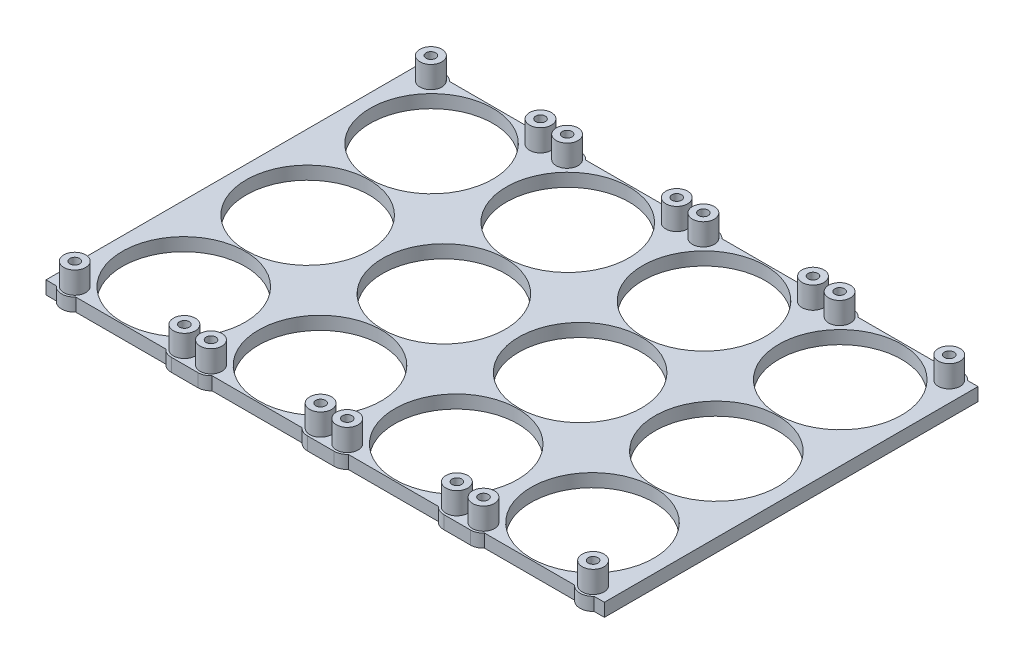
from build123d import *

# Parameters (mm, degrees)
SKETCH1_W           = 127.76
SKETCH1_H           = 85.48
SKETCH1_R           = 14.05
BOSS_EXTRUDE3_DEPTH = 3
BOSS_EXTRUDE4_DEPTH = 3
BOSS_EXTRUDE5_START = 3
SKETCH7_R           = 2.5
BOSS_EXTRUDE5_DEPTH = 5
CUT_EXTRUDE1_START  = 5
SKETCH4_R           = 1.1
CUT_EXTRUDE1_DEPTH  = 5


with BuildPart() as part:
    # Sketch1 → Boss-Extrude3 (new body)
    with BuildSketch(Plane(origin=(0, 0, 0), x_dir=(1, 0, 0), z_dir=(0, 1, 0))):
        with Locations((63.88, -42.74)):
            Rectangle(SKETCH1_W, SKETCH1_H)
        with Locations(Location((17.122, -71.085, 0), (0, 0, 270))):
            Circle(SKETCH1_R, mode=Mode.SUBTRACT)
        with Locations(Location((17.122, -42.74, 0), (0, 0, 270))):
            Circle(SKETCH1_R, mode=Mode.SUBTRACT)
        with Locations(Location((110.638, -71.085, 0), (0, 0, 270))):
            Circle(SKETCH1_R, mode=Mode.SUBTRACT)
        with Locations(Location((79.466, -71.085, 0), (0, 0, 270))):
            Circle(SKETCH1_R, mode=Mode.SUBTRACT)
        with Locations(Location((48.294, -71.085, 0), (0, 0, 270))):
            Circle(SKETCH1_R, mode=Mode.SUBTRACT)
        with Locations(Location((110.638, -42.74, 0), (0, 0, 270))):
            Circle(SKETCH1_R, mode=Mode.SUBTRACT)
        with Locations(Location((79.466, -42.74, 0), (0, 0, 270))):
            Circle(SKETCH1_R, mode=Mode.SUBTRACT)
        with Locations(Location((48.294, -42.74, 0), (0, 0, 270))):
            Circle(SKETCH1_R, mode=Mode.SUBTRACT)
        with Locations(Location((110.638, -14.395, 0), (0, 0, 270))):
            Circle(SKETCH1_R, mode=Mode.SUBTRACT)
        with Locations(Location((79.466, -14.395, 0), (0, 0, 270))):
            Circle(SKETCH1_R, mode=Mode.SUBTRACT)
        with Locations(Location((48.294, -14.395, 0), (0, 0, 270))):
            Circle(SKETCH1_R, mode=Mode.SUBTRACT)
        with Locations(Location((17.122, -14.395, 0), (0, 0, 270))):
            Circle(SKETCH1_R, mode=Mode.SUBTRACT)
    extrude(amount=BOSS_EXTRUDE3_DEPTH)

    # Sketch2 → Boss-Extrude4 (add)
    with BuildSketch(Plane.XZ):
        with BuildLine():
            ThreePointArc((2.345932023, 0), (4.582, -1), (6.818067977, 0))
            Line((6.818067977, 0), (2.345932023, 0))
        make_face()
        with BuildLine():
            Line((2.345932023, 0), (6.818067977, 0))
            ThreePointArc((6.818067977, 0), (7.384517077, 0.929533731), (7.582, 2))
            ThreePointArc((7.582, 2), (3.511533731, 4.802517077), (2.345932023, 0))
        make_face()
        with BuildLine():
            ThreePointArc((32.662, 2), (31.783320344, 4.121320344), (29.662, 5))
            Line((29.662, 5), (29.662, 0))
            Line((29.662, 0), (31.898067977, 0))
            ThreePointArc((31.898067977, 0), (32.464517077, 0.929533731), (32.662, 2))
        make_face()
        with BuildLine():
            Line((29.662, 0), (29.662, 5))
            ThreePointArc((29.662, 5), (26.923387212, 3.224744871), (27.425932023, 0))
            Line((27.425932023, 0), (29.662, 0))
        make_face()
        with BuildLine():
            Line((31.898067977, 0), (29.662, 0))
            Line((29.662, 0), (29.662, -1))
            ThreePointArc((29.662, -1), (30.886744871, -0.738612788), (31.898067977, 0))
        make_face()
        with BuildLine():
            Line((29.662, -1), (29.662, 0))
            Line((29.662, 0), (27.425932023, 0))
            ThreePointArc((27.425932023, 0), (28.437255129, -0.738612788), (29.662, -1))
        make_face()
        with BuildLine():
            ThreePointArc((35.754, -1), (34.529255129, -0.738612788), (33.517932023, 0))
            Line((33.517932023, 0), (31.898067977, 0))
            ThreePointArc((31.898067977, 0), (30.886744871, -0.738612788), (29.662, -1))
            Line((29.662, -1), (35.754, -1))
        make_face()
        with BuildLine():
            ThreePointArc((38.754, 2), (37.875320344, 4.121320344), (35.754, 5))
            Line((35.754, 5), (35.754, 0))
            Line((35.754, 0), (37.990067977, 0))
            ThreePointArc((37.990067977, 0), (38.556517077, 0.929533731), (38.754, 2))
        make_face()
        with BuildLine():
            Line((35.754, 0), (35.754, 5))
            ThreePointArc((35.754, 5), (33.015387212, 3.224744871), (33.517932023, 0))
            Line((33.517932023, 0), (35.754, 0))
        make_face()
        with BuildLine():
            Line((37.990067977, 0), (35.754, 0))
            Line((35.754, 0), (35.754, -1))
            ThreePointArc((35.754, -1), (36.978744871, -0.738612788), (37.990067977, 0))
        make_face()
        with BuildLine():
            Line((35.754, -1), (35.754, 0))
            Line((35.754, 0), (33.517932023, 0))
            ThreePointArc((33.517932023, 0), (34.529255129, -0.738612788), (35.754, -1))
        make_face()
        with BuildLine():
            ThreePointArc((60.834, 5), (58.095387212, 3.224744871), (58.597932023, 0))
            Line((58.597932023, 0), (60.834, 0))
            Line((60.834, 0), (60.834, 5))
        make_face()
        with BuildLine():
            Line((60.834, 0), (58.597932023, 0))
            ThreePointArc((58.597932023, 0), (59.609255129, -0.738612788), (60.834, -1))
            Line((60.834, -1), (60.834, 0))
        make_face()
        with BuildLine():
            ThreePointArc((63.834, 2), (62.955320344, 4.121320344), (60.834, 5))
            Line((60.834, 5), (60.834, 0))
            Line((60.834, 0), (63.070067977, 0))
            ThreePointArc((63.070067977, 0), (63.636517077, 0.929533731), (63.834, 2))
        make_face()
        with BuildLine():
            Line((60.834, 0), (60.834, -1))
            ThreePointArc((60.834, -1), (62.058744871, -0.738612788), (63.070067977, 0))
            Line((63.070067977, 0), (60.834, 0))
        make_face()
        with BuildLine():
            ThreePointArc((63.070067977, 0), (62.058744871, -0.738612788), (60.834, -1))
            Line((60.834, -1), (66.926, -1))
            ThreePointArc((66.926, -1), (65.701255129, -0.738612788), (64.689932023, 0))
            Line((64.689932023, 0), (63.070067977, 0))
        make_face()
        with BuildLine():
            ThreePointArc((69.926, 2), (69.047320344, 4.121320344), (66.926, 5))
            Line((66.926, 5), (66.926, 0))
            Line((66.926, 0), (69.162067977, 0))
            ThreePointArc((69.162067977, 0), (69.728517077, 0.929533731), (69.926, 2))
        make_face()
        with BuildLine():
            Line((66.926, 0), (66.926, 5))
            ThreePointArc((66.926, 5), (64.187387212, 3.224744871), (64.689932023, 0))
            Line((64.689932023, 0), (66.926, 0))
        make_face()
        with BuildLine():
            ThreePointArc((64.689932023, 0), (65.701255129, -0.738612788), (66.926, -1))
            Line((66.926, -1), (66.926, 0))
            Line((66.926, 0), (64.689932023, 0))
        make_face()
        with BuildLine():
            Line((66.926, 0), (66.926, -1))
            ThreePointArc((66.926, -1), (68.150744871, -0.738612788), (69.162067977, 0))
            Line((69.162067977, 0), (66.926, 0))
        make_face()
        with BuildLine():
            ThreePointArc((92.006, 5), (89.267387212, 3.224744871), (89.769932023, 0))
            Line((89.769932023, 0), (92.006, 0))
            Line((92.006, 0), (92.006, 5))
        make_face()
        with BuildLine():
            Line((92.006, 0), (89.769932023, 0))
            ThreePointArc((89.769932023, 0), (90.781255129, -0.738612788), (92.006, -1))
            Line((92.006, -1), (92.006, 0))
        make_face()
        with BuildLine():
            ThreePointArc((95.006, 2), (94.127320344, 4.121320344), (92.006, 5))
            Line((92.006, 5), (92.006, 0))
            Line((92.006, 0), (94.242067977, 0))
            ThreePointArc((94.242067977, 0), (94.808517077, 0.929533731), (95.006, 2))
        make_face()
        with BuildLine():
            Line((92.006, 0), (92.006, -1))
            ThreePointArc((92.006, -1), (93.230744871, -0.738612788), (94.242067977, 0))
            Line((94.242067977, 0), (92.006, 0))
        make_face()
        with BuildLine():
            ThreePointArc((94.242067977, 0), (93.230744871, -0.738612788), (92.006, -1))
            Line((92.006, -1), (98.098, -1))
            ThreePointArc((98.098, -1), (96.873255129, -0.738612788), (95.861932023, 0))
            Line((95.861932023, 0), (94.242067977, 0))
        make_face()
        with BuildLine():
            ThreePointArc((101.098, 2), (100.219320344, 4.121320344), (98.098, 5))
            Line((98.098, 5), (98.098, 0))
            Line((98.098, 0), (100.334067977, 0))
            ThreePointArc((100.334067977, 0), (100.900517077, 0.929533731), (101.098, 2))
        make_face()
        with BuildLine():
            Line((98.098, 0), (98.098, 5))
            ThreePointArc((98.098, 5), (95.359387212, 3.224744871), (95.861932023, 0))
            Line((95.861932023, 0), (98.098, 0))
        make_face()
        with BuildLine():
            ThreePointArc((95.861932023, 0), (96.873255129, -0.738612788), (98.098, -1))
            Line((98.098, -1), (98.098, 0))
            Line((98.098, 0), (95.861932023, 0))
        make_face()
        with BuildLine():
            Line((98.098, 0), (98.098, -1))
            ThreePointArc((98.098, -1), (99.322744871, -0.738612788), (100.334067977, 0))
            Line((100.334067977, 0), (98.098, 0))
        make_face()
        with BuildLine():
            ThreePointArc((126.178, 2), (122.107533731, 4.802517077), (120.941932023, 0))
            Line((120.941932023, 0), (125.414067977, 0))
            ThreePointArc((125.414067977, 0), (125.980517077, 0.929533731), (126.178, 2))
        make_face()
        with BuildLine():
            Line((125.414067977, 0), (120.941932023, 0))
            ThreePointArc((120.941932023, 0), (123.178, -1), (125.414067977, 0))
        make_face()
        with BuildLine():
            ThreePointArc((125.414067977, 85.48), (123.178, 86.48), (120.941932023, 85.48))
            Line((120.941932023, 85.48), (125.414067977, 85.48))
        make_face()
        with BuildLine():
            Line((125.414067977, 85.48), (120.941932023, 85.48))
            ThreePointArc((120.941932023, 85.48), (122.107533731, 80.677482923), (126.178, 83.48))
            ThreePointArc((126.178, 83.48), (125.980517077, 84.550466269), (125.414067977, 85.48))
        make_face()
        with BuildLine():
            ThreePointArc((100.334067977, 85.48), (99.322744871, 86.218612788), (98.098, 86.48))
            Line((98.098, 86.48), (98.098, 85.48))
            Line((98.098, 85.48), (100.334067977, 85.48))
        make_face()
        with BuildLine():
            Line((98.098, 85.48), (98.098, 86.48))
            ThreePointArc((98.098, 86.48), (96.873255129, 86.218612788), (95.861932023, 85.48))
            Line((95.861932023, 85.48), (98.098, 85.48))
        make_face()
        with BuildLine():
            Line((100.334067977, 85.48), (98.098, 85.48))
            Line((98.098, 85.48), (98.098, 80.48))
            ThreePointArc((98.098, 80.48), (100.219320344, 81.358679656), (101.098, 83.48))
            ThreePointArc((101.098, 83.48), (100.900517077, 84.550466269), (100.334067977, 85.48))
        make_face()
        with BuildLine():
            Line((98.098, 80.48), (98.098, 85.48))
            Line((98.098, 85.48), (95.861932023, 85.48))
            ThreePointArc((95.861932023, 85.48), (95.359387212, 82.255255129), (98.098, 80.48))
        make_face()
        with BuildLine():
            Line((98.098, 86.48), (92.006, 86.48))
            ThreePointArc((92.006, 86.48), (93.230744871, 86.218612788), (94.242067977, 85.48))
            Line((94.242067977, 85.48), (95.861932023, 85.48))
            ThreePointArc((95.861932023, 85.48), (96.873255129, 86.218612788), (98.098, 86.48))
        make_face()
        with BuildLine():
            ThreePointArc((94.242067977, 85.48), (93.230744871, 86.218612788), (92.006, 86.48))
            Line((92.006, 86.48), (92.006, 85.48))
            Line((92.006, 85.48), (94.242067977, 85.48))
        make_face()
        with BuildLine():
            Line((92.006, 85.48), (92.006, 86.48))
            ThreePointArc((92.006, 86.48), (90.781255129, 86.218612788), (89.769932023, 85.48))
            Line((89.769932023, 85.48), (92.006, 85.48))
        make_face()
        with BuildLine():
            Line((94.242067977, 85.48), (92.006, 85.48))
            Line((92.006, 85.48), (92.006, 80.48))
            ThreePointArc((92.006, 80.48), (94.127320344, 81.358679656), (95.006, 83.48))
            ThreePointArc((95.006, 83.48), (94.808517077, 84.550466269), (94.242067977, 85.48))
        make_face()
        with BuildLine():
            Line((92.006, 80.48), (92.006, 85.48))
            Line((92.006, 85.48), (89.769932023, 85.48))
            ThreePointArc((89.769932023, 85.48), (89.267387212, 82.255255129), (92.006, 80.48))
        make_face()
        with BuildLine():
            ThreePointArc((69.926, 83.48), (69.728517077, 84.550466269), (69.162067977, 85.48))
            Line((69.162067977, 85.48), (66.926, 85.48))
            Line((66.926, 85.48), (66.926, 80.48))
            ThreePointArc((66.926, 80.48), (69.047320344, 81.358679656), (69.926, 83.48))
        make_face()
        with BuildLine():
            Line((66.926, 85.48), (69.162067977, 85.48))
            ThreePointArc((69.162067977, 85.48), (68.150744871, 86.218612788), (66.926, 86.48))
            Line((66.926, 86.48), (66.926, 85.48))
        make_face()
        with BuildLine():
            Line((66.926, 85.48), (66.926, 86.48))
            ThreePointArc((66.926, 86.48), (65.701255129, 86.218612788), (64.689932023, 85.48))
            Line((64.689932023, 85.48), (66.926, 85.48))
        make_face()
        with BuildLine():
            Line((66.926, 80.48), (66.926, 85.48))
            Line((66.926, 85.48), (64.689932023, 85.48))
            ThreePointArc((64.689932023, 85.48), (64.187387212, 82.255255129), (66.926, 80.48))
        make_face()
        with BuildLine():
            ThreePointArc((64.689932023, 85.48), (65.701255129, 86.218612788), (66.926, 86.48))
            Line((66.926, 86.48), (60.834, 86.48))
            ThreePointArc((60.834, 86.48), (62.058744871, 86.218612788), (63.070067977, 85.48))
            Line((63.070067977, 85.48), (64.689932023, 85.48))
        make_face()
        with BuildLine():
            ThreePointArc((63.070067977, 85.48), (62.058744871, 86.218612788), (60.834, 86.48))
            Line((60.834, 86.48), (60.834, 85.48))
            Line((60.834, 85.48), (63.070067977, 85.48))
        make_face()
        with BuildLine():
            Line((60.834, 85.48), (60.834, 86.48))
            ThreePointArc((60.834, 86.48), (59.609255129, 86.218612788), (58.597932023, 85.48))
            Line((58.597932023, 85.48), (60.834, 85.48))
        make_face()
        with BuildLine():
            ThreePointArc((58.597932023, 85.48), (58.095387212, 82.255255129), (60.834, 80.48))
            Line((60.834, 80.48), (60.834, 85.48))
            Line((60.834, 85.48), (58.597932023, 85.48))
        make_face()
        with BuildLine():
            Line((60.834, 85.48), (60.834, 80.48))
            ThreePointArc((60.834, 80.48), (62.955320344, 81.358679656), (63.834, 83.48))
            ThreePointArc((63.834, 83.48), (63.636517077, 84.550466269), (63.070067977, 85.48))
            Line((63.070067977, 85.48), (60.834, 85.48))
        make_face()
        with BuildLine():
            ThreePointArc((7.582, 83.48), (7.384517077, 84.550466269), (6.818067977, 85.48))
            Line((6.818067977, 85.48), (2.345932023, 85.48))
            ThreePointArc((2.345932023, 85.48), (3.511533731, 80.677482923), (7.582, 83.48))
        make_face()
        with BuildLine():
            Line((2.345932023, 85.48), (6.818067977, 85.48))
            ThreePointArc((6.818067977, 85.48), (4.582, 86.48), (2.345932023, 85.48))
        make_face()
        with BuildLine():
            ThreePointArc((31.898067977, 85.48), (30.886744871, 86.218612788), (29.662, 86.48))
            Line((29.662, 86.48), (29.662, 85.48))
            Line((29.662, 85.48), (31.898067977, 85.48))
        make_face()
        with BuildLine():
            Line((29.662, 85.48), (29.662, 86.48))
            ThreePointArc((29.662, 86.48), (28.437255129, 86.218612788), (27.425932023, 85.48))
            Line((27.425932023, 85.48), (29.662, 85.48))
        make_face()
        with BuildLine():
            ThreePointArc((27.425932023, 85.48), (26.923387212, 82.255255129), (29.662, 80.48))
            Line((29.662, 80.48), (29.662, 85.48))
            Line((29.662, 85.48), (27.425932023, 85.48))
        make_face()
        with BuildLine():
            Line((29.662, 85.48), (29.662, 80.48))
            ThreePointArc((29.662, 80.48), (31.783320344, 81.358679656), (32.662, 83.48))
            ThreePointArc((32.662, 83.48), (32.464517077, 84.550466269), (31.898067977, 85.48))
            Line((31.898067977, 85.48), (29.662, 85.48))
        make_face()
        with BuildLine():
            ThreePointArc((33.517932023, 85.48), (34.529255129, 86.218612788), (35.754, 86.48))
            Line((35.754, 86.48), (29.662, 86.48))
            ThreePointArc((29.662, 86.48), (30.886744871, 86.218612788), (31.898067977, 85.48))
            Line((31.898067977, 85.48), (33.517932023, 85.48))
        make_face()
        with BuildLine():
            ThreePointArc((38.754, 83.48), (38.556517077, 84.550466269), (37.990067977, 85.48))
            Line((37.990067977, 85.48), (35.754, 85.48))
            Line((35.754, 85.48), (35.754, 80.48))
            ThreePointArc((35.754, 80.48), (37.875320344, 81.358679656), (38.754, 83.48))
        make_face()
        with BuildLine():
            Line((35.754, 85.48), (37.990067977, 85.48))
            ThreePointArc((37.990067977, 85.48), (36.978744871, 86.218612788), (35.754, 86.48))
            Line((35.754, 86.48), (35.754, 85.48))
        make_face()
        with BuildLine():
            Line((35.754, 85.48), (35.754, 86.48))
            ThreePointArc((35.754, 86.48), (34.529255129, 86.218612788), (33.517932023, 85.48))
            Line((33.517932023, 85.48), (35.754, 85.48))
        make_face()
        with BuildLine():
            Line((35.754, 80.48), (35.754, 85.48))
            Line((35.754, 85.48), (33.517932023, 85.48))
            ThreePointArc((33.517932023, 85.48), (33.015387212, 82.255255129), (35.754, 80.48))
        make_face()
    extrude(amount=-BOSS_EXTRUDE4_DEPTH)

    # Sketch7 → Boss-Extrude5 (add)
    with BuildSketch(Plane(origin=(0, 0, 0), x_dir=(1, 0, 0), z_dir=(0, 1, 0)).offset(BOSS_EXTRUDE5_START)):
        with Locations(Location((4.582, -83.48, 0), (0, 0, 270))):
            Circle(SKETCH7_R)
        with Locations(Location((29.662, -83.48, 0), (0, 0, 270))):
            Circle(SKETCH7_R)
        with Locations(Location((29.662, -2, 0), (0, 0, 270))):
            Circle(SKETCH7_R)
        with Locations(Location((4.582, -2, 0), (0, 0, 270))):
            Circle(SKETCH7_R)
        with Locations(Location((35.754, -83.48, 0), (0, 0, 270))):
            Circle(SKETCH7_R)
        with Locations(Location((60.834, -83.48, 0), (0, 0, 270))):
            Circle(SKETCH7_R)
        with Locations(Location((60.834, -2, 0), (0, 0, 270))):
            Circle(SKETCH7_R)
        with Locations(Location((35.754, -2, 0), (0, 0, 270))):
            Circle(SKETCH7_R)
        with Locations(Location((66.926, -83.48, 0), (0, 0, 270))):
            Circle(SKETCH7_R)
        with Locations(Location((92.006, -83.48, 0), (0, 0, 270))):
            Circle(SKETCH7_R)
        with Locations(Location((92.006, -2, 0), (0, 0, 270))):
            Circle(SKETCH7_R)
        with Locations(Location((66.926, -2, 0), (0, 0, 270))):
            Circle(SKETCH7_R)
        with Locations(Location((98.098, -83.48, 0), (0, 0, 270))):
            Circle(SKETCH7_R)
        with Locations(Location((123.178, -83.48, 0), (0, 0, 270))):
            Circle(SKETCH7_R)
        with Locations(Location((123.178, -2, 0), (0, 0, 270))):
            Circle(SKETCH7_R)
        with Locations(Location((98.098, -2, 0), (0, 0, 270))):
            Circle(SKETCH7_R)
    extrude(amount=BOSS_EXTRUDE5_DEPTH)

    # Sketch4 → Cut-Extrude1 (cut)
    with BuildSketch(Plane(origin=(0, 3, 0), x_dir=(1, 0, 0), z_dir=(0, 1, 0)).offset(CUT_EXTRUDE1_START)):
        with Locations(Location((4.582, -83.48, 0), (0, 0, 270))):
            Circle(SKETCH4_R)
        with Locations(Location((29.662, -83.48, 0), (0, 0, 270))):
            Circle(SKETCH4_R)
        with Locations(Location((29.662, -2, 0), (0, 0, 270))):
            Circle(SKETCH4_R)
        with Locations(Location((4.582, -2, 0), (0, 0, 270))):
            Circle(SKETCH4_R)
        with Locations(Location((35.754, -83.48, 0), (0, 0, 270))):
            Circle(SKETCH4_R)
        with Locations(Location((60.834, -83.48, 0), (0, 0, 270))):
            Circle(SKETCH4_R)
        with Locations(Location((60.834, -2, 0), (0, 0, 270))):
            Circle(SKETCH4_R)
        with Locations(Location((35.754, -2, 0), (0, 0, 270))):
            Circle(SKETCH4_R)
        with Locations(Location((66.926, -83.48, 0), (0, 0, 270))):
            Circle(SKETCH4_R)
        with Locations(Location((92.006, -83.48, 0), (0, 0, 270))):
            Circle(SKETCH4_R)
        with Locations(Location((92.006, -2, 0), (0, 0, 270))):
            Circle(SKETCH4_R)
        with Locations(Location((66.926, -2, 0), (0, 0, 270))):
            Circle(SKETCH4_R)
        with Locations(Location((98.098, -83.48, 0), (0, 0, 270))):
            Circle(SKETCH4_R)
        with Locations(Location((123.178, -83.48, 0), (0, 0, 270))):
            Circle(SKETCH4_R)
        with Locations(Location((123.178, -2, 0), (0, 0, 270))):
            Circle(SKETCH4_R)
        with Locations(Location((98.098, -2, 0), (0, 0, 270))):
            Circle(SKETCH4_R)
    extrude(amount=-CUT_EXTRUDE1_DEPTH, mode=Mode.SUBTRACT)


solid = part.part
